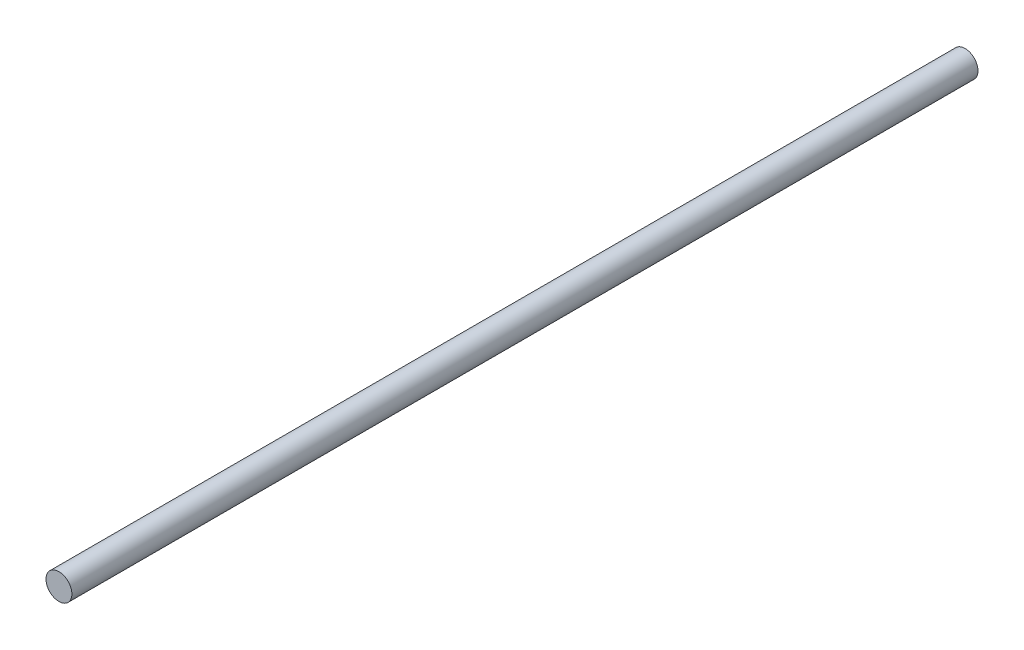
from build123d import *

# Parameters (mm, degrees)
SKETCH1_R           = 1
BOSS_EXTRUDE1_DEPTH = 70


with BuildPart() as part:
    # Sketch1 → Boss-Extrude1 (new body)
    with BuildSketch(Plane.XY):
        Circle(SKETCH1_R)
    extrude(amount=BOSS_EXTRUDE1_DEPTH)


solid = part.part
